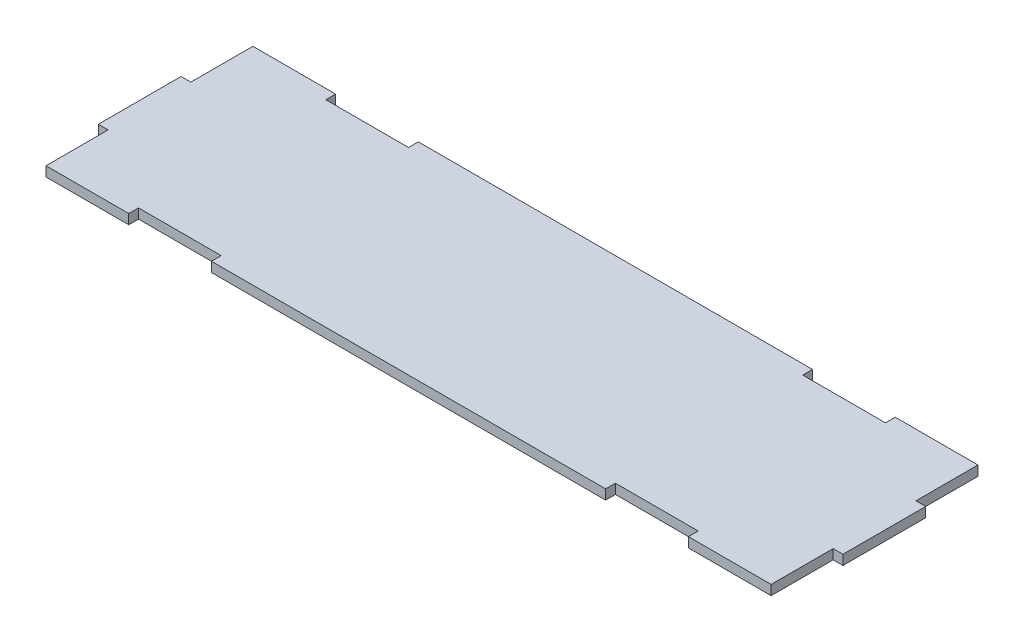
from build123d import *

# Parameters (mm, degrees)
BOSS_EXTRUDE1_DEPTH = 2.3622


with BuildPart() as part:
    # Sketch1 → Boss-Extrude1 (new body)
    with BuildSketch(Plane(origin=(0, 0, 0), x_dir=(1, 0, 0), z_dir=(0, 1, 0))):
        Polygon((-47.407001047, 79.004909759), (-27.407001047, 79.004909759), (-27.407001047, 76.642709759), (-7.407001047, 76.642709759), (-7.407001047, 79.004909759), (87.868597927, 79.004909759), (87.868597927, 76.642709759), (107.868597927, 76.642709759), (107.868597927, 79.004909759), (127.868597927, 79.004909759), (127.868597927, 64.004909759), (130.230798953, 64.004909759), (130.230798953, 44.004909759), (127.868598953, 44.004909759), (127.868598953, 29.004909759), (107.868597927, 29.004909759), (107.868597927, 31.367109759), (87.868597927, 31.367109759), (87.868597927, 29.004909759), (-7.407001047, 29.004909759), (-7.407001047, 31.367109759), (-27.407001047, 31.367109759), (-27.407001047, 29.004909759), (-47.407001047, 29.004909759), (-47.407001047, 44.004909759), (-49.769201047, 44.004909759), (-49.769201047, 64.004909759), (-47.407001047, 64.004909759), align=None)
    extrude(amount=BOSS_EXTRUDE1_DEPTH)


solid = part.part
